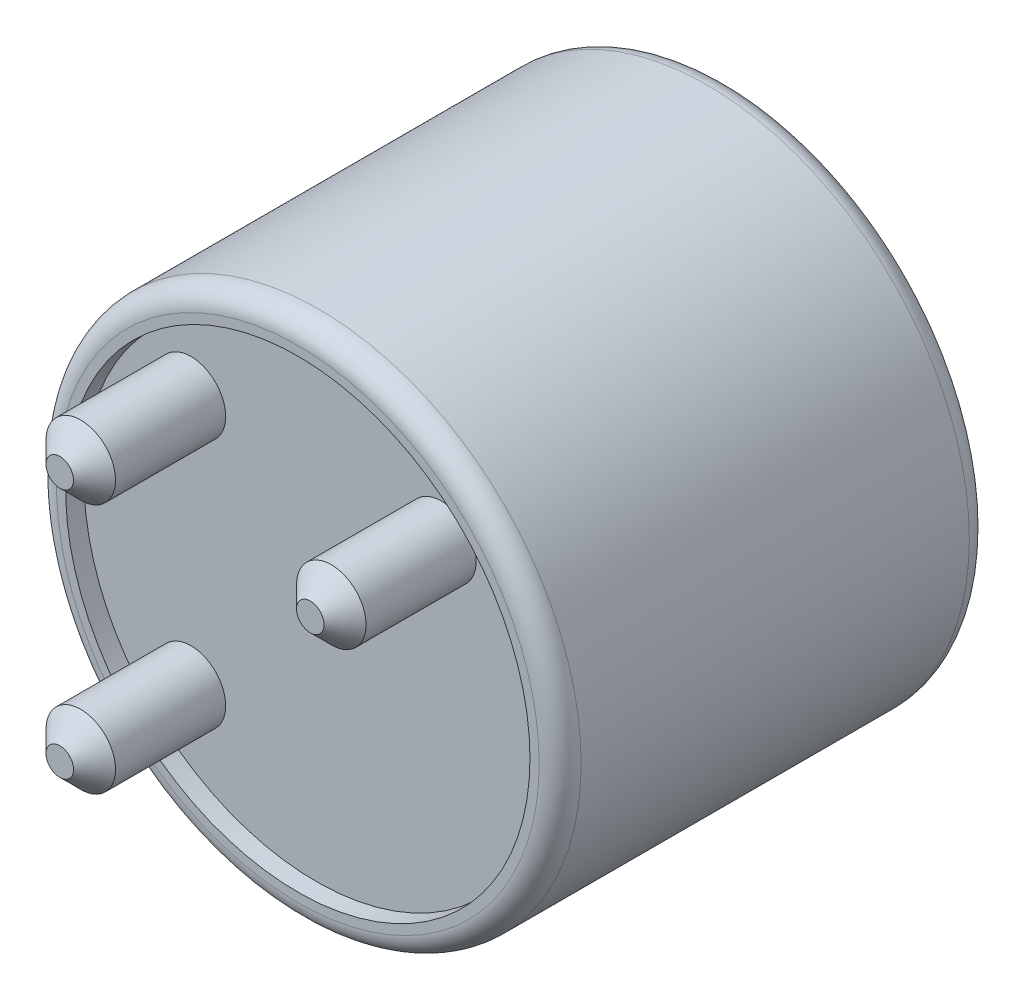
from build123d import *

# Parameters (mm, degrees)
SKETCH_1_R          = 10
EXTRUDE_1_DEPTH     = 16.4
SKETCH_2_R          = 8.85
CUT_EXTRUDE_1_DEPTH = 0.7
SKETCH_3_R          = 1.325
EXTRUDE_2_DEPTH     = 5
CHAMFER_1_SIZE      = 0.8
SKETCH_4_R          = 8.05
CUT_EXTRUDE_2_DEPTH = 1.5
SKETCH_5_R          = 0.6
CUT_EXTRUDE_3_DEPTH = 3
FILLET_1_R          = 0.8


with BuildPart() as part:
    # Эскиз1 → Бобышка-Вытянуть1 (new body)
    with BuildSketch(Plane.XY):
        Circle(SKETCH_1_R)
    extrude(amount=EXTRUDE_1_DEPTH)

    # Эскиз2 → Вырез-Вытянуть1 (cut)
    with BuildSketch(Plane.XY.offset(16.4)):
        Circle(SKETCH_2_R)
    extrude(amount=-CUT_EXTRUDE_1_DEPTH, mode=Mode.SUBTRACT)

    # Эскиз3 → Бобышка-Вытянуть2 (add)
    with BuildSketch(Plane.XY.offset(15.7)):
        with Locations((-4.775, 4.775)):
            Circle(SKETCH_3_R)
        with Locations((-4.775, -4.775)):
            Circle(SKETCH_3_R)
        with Locations((4.775, 4.775)):
            Circle(SKETCH_3_R)
    extrude(amount=EXTRUDE_2_DEPTH)

    # Фаска1
    chamfer_1_edges = [part.edges().sort_by_distance(p)[0] for p in [
        (-6.1, 4.775, 20.7),
        (-6.1, -4.775, 20.7),
        (3.45, 4.775, 20.7),
    ]]
    chamfer(chamfer_1_edges, length=CHAMFER_1_SIZE)

    # Эскиз4 → Вырез-Вытянуть2 (cut)
    with BuildSketch(Plane(origin=(0, 0, 0), x_dir=(-1, 0, 0), z_dir=(0, 0, -1))):
        Circle(SKETCH_4_R)
    extrude(amount=-CUT_EXTRUDE_2_DEPTH, mode=Mode.SUBTRACT)

    # Эскиз5 → Вырез-Вытянуть3 (cut)
    with BuildSketch(Plane(origin=(0, 0, 1.5), x_dir=(-1, 0, 0), z_dir=(0, 0, -1))):
        Circle(SKETCH_5_R)
    extrude(amount=-CUT_EXTRUDE_3_DEPTH, mode=Mode.SUBTRACT)

    # Скругление1
    fillet_1_edges = [part.edges().sort_by_distance(p)[0] for p in [
        (-10, 0, 0),
        (-10, 0, 16.4),
    ]]
    fillet(fillet_1_edges, radius=FILLET_1_R)


solid = part.part
